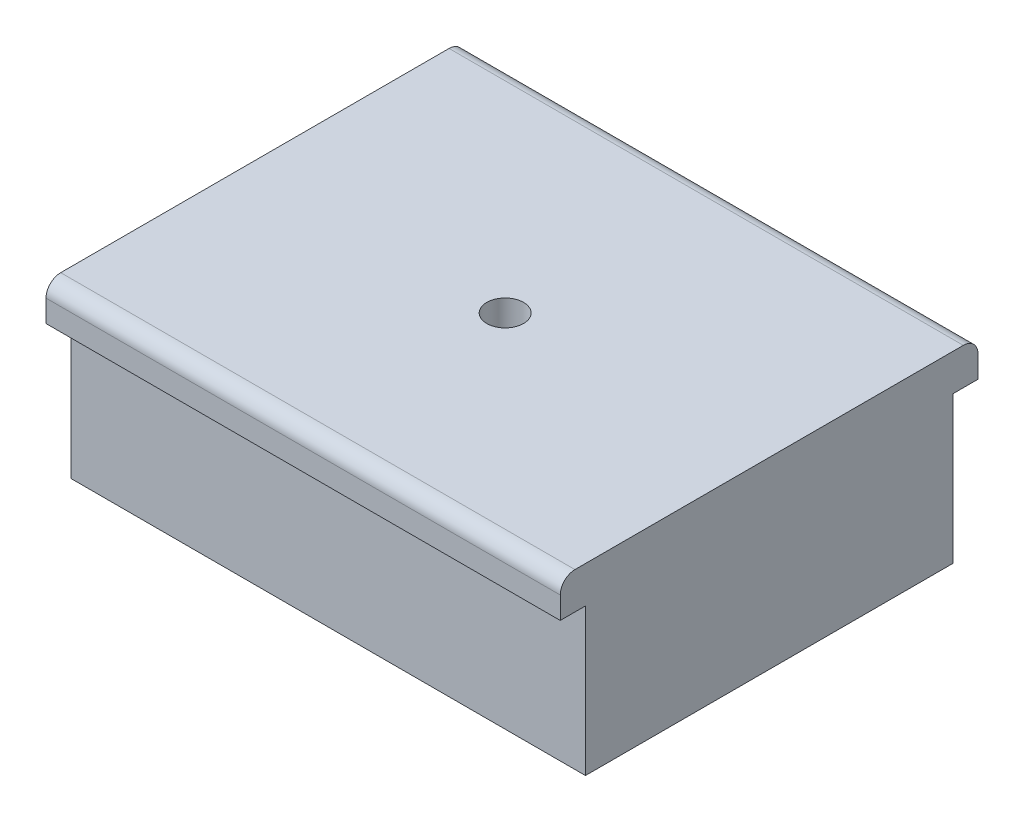
from build123d import *

# Parameters (mm, degrees)
BOSS_EXTRUDE1_DEPTH = 1778
SKETCH2_R           = 63.5
CUT_EXTRUDE1_DEPTH  = 1778


with BuildPart() as part:
    # Sketch1 → Boss-Extrude1 (new body)
    with BuildSketch(Plane(origin=(0, 0, 0), x_dir=(0, 0, -1), z_dir=(1, 0, 0))):
        with BuildLine():
            Line((0, 0), (1270, 0))
            Line((1270, 0), (1270, 508))
            Line((1270, 508), (1357.172672295, 508))
            Line((1357.172672295, 508), (1357.172672295, 584.2))
            ThreePointArc((1357.172672295, 584.2), (1342.293696779, 620.121024484), (1306.372672295, 635))
            Line((1306.372672295, 635), (-36.372672295, 635))
            ThreePointArc((-36.372672295, 635), (-72.293696779, 620.121024484), (-87.172672295, 584.2))
            Line((-87.172672295, 584.2), (-87.172672295, 508))
            Line((-87.172672295, 508), (0, 508))
            Line((0, 508), (0, 0))
        make_face()
    extrude(amount=BOSS_EXTRUDE1_DEPTH)

    # Sketch2 → Cut-Extrude1 (cut)
    with BuildSketch(Plane(origin=(0, 635, 0), x_dir=(1, 0, 0), z_dir=(0, 1, 0))):
        with Locations(Location((889, 611.327327705, 0), (0, 0, 270))):
            Circle(SKETCH2_R)
    extrude(amount=-CUT_EXTRUDE1_DEPTH, mode=Mode.SUBTRACT)


solid = part.part
